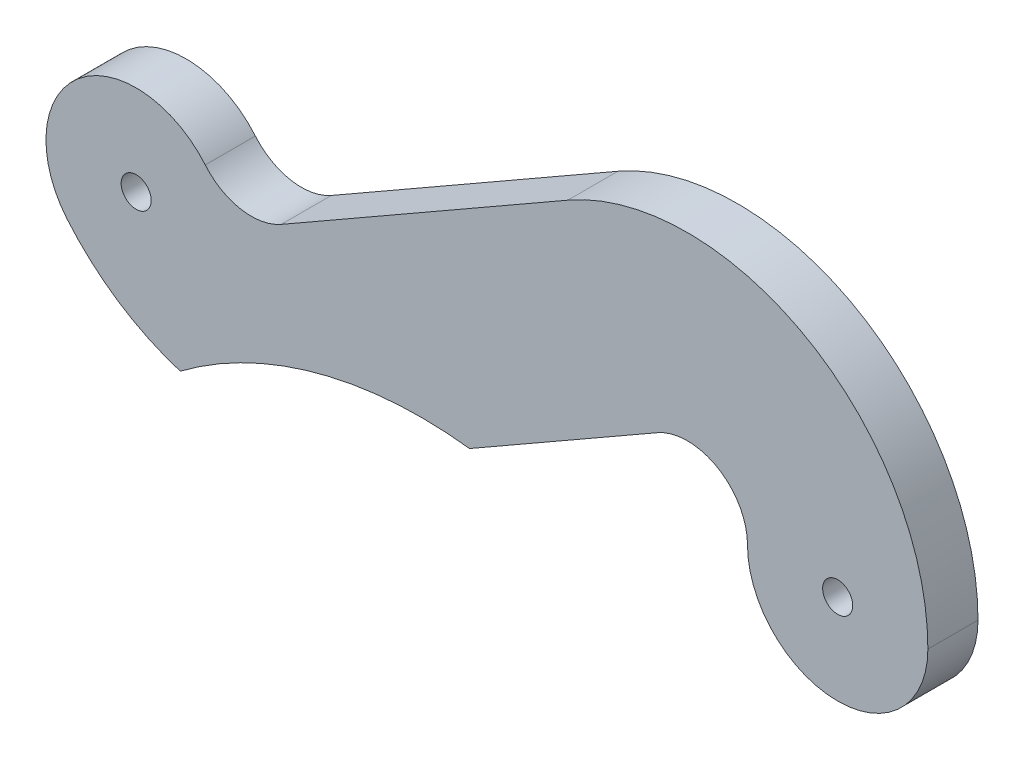
from build123d import *

# Parameters (mm, degrees)
ESQUISSE1_R             = 1.5
BOSS_EXTRU_1_DEPTH      = 5
ENL_V_MAT_EXTRU_1_DEPTH = 10


with BuildPart() as part:
    # Esquisse1 → Boss.-Extru.1 (new body)
    with BuildSketch(Plane.XY):
        with BuildLine():
            Line((14.474115402, 4.43614094), (43.066204977, 20.822692822))
            ThreePointArc((43.066204977, 20.822692822), (67.033056957, 20.765489165), (79, 0))
            ThreePointArc((79, 0), (70, -9), (61, 0))
            ThreePointArc((61, 0), (58.008264239, 5.191372291), (52.016551244, 5.205673206))
            Line((52.016551244, 5.205673206), (23.424461669, -11.180878677))
            ThreePointArc((23.424461669, -11.180878677), (7.285507399, -13.986910655), (-6.894399988, -5.785088487))
            ThreePointArc((-6.894399988, -5.785088487), (-5.785088487, 6.894399988), (6.894399988, 5.785088487))
            ThreePointArc((6.894399988, 5.785088487), (10.439376835, 3.734632945), (14.474115402, 4.43614094))
        make_face()
        with Locations((70, 0)):
            Circle(ESQUISSE1_R, mode=Mode.SUBTRACT)
        Circle(ESQUISSE1_R, mode=Mode.SUBTRACT)
    extrude(amount=BOSS_EXTRU_1_DEPTH)

    # Esquisse2 → Enlèv. mat.-Extru.1 (cut)
    with BuildSketch(Plane.XY.offset(5)):
        with BuildLine():
            ThreePointArc((4.401541671, -13.287300689), (18.082976377, -6.617066031), (33.265702076, -5.540717398))
            ThreePointArc((33.265702076, -5.540717398), (20.118574556, -14.201807608), (4.401541671, -13.287300689))
        make_face()
    extrude(amount=-ENL_V_MAT_EXTRU_1_DEPTH, mode=Mode.SUBTRACT)


solid = part.part
